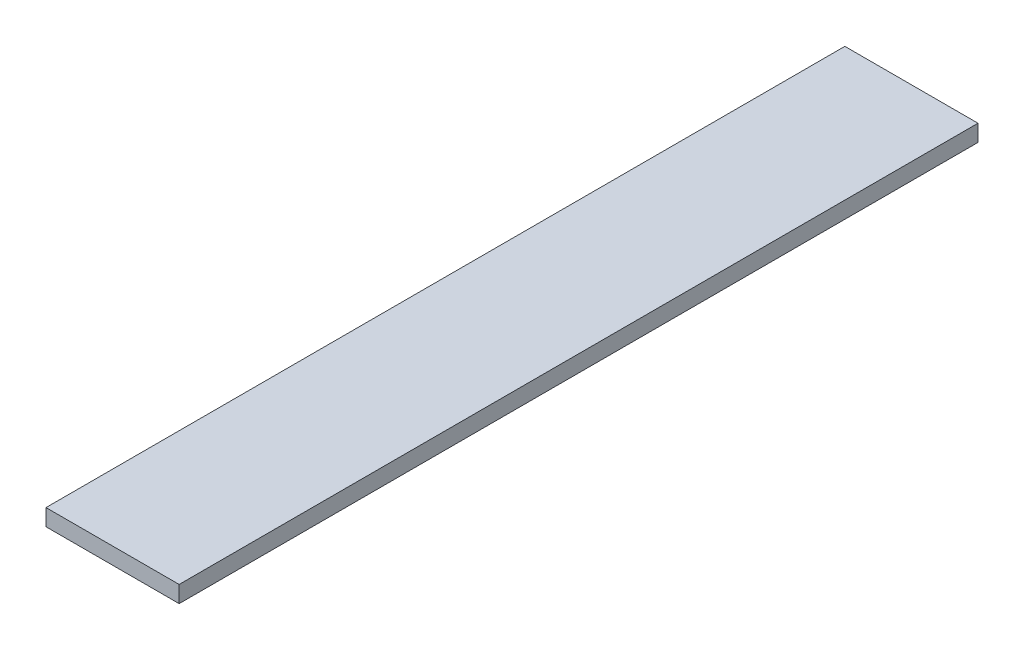
from build123d import *

# Parameters (mm, degrees)
BOSS_EXTRUDE1_DEPTH      = 76.2
BOSS_EXTRUDE1_DEPTH_BACK = 76.2
SKETCH3_W                = 25.4
SKETCH3_H                = 3.175


with BuildPart() as part:
    # Sketch3 → Boss-Extrude1 (new, two sides: drawn at the far end of the back side and taken through both)
    with BuildSketch(Plane.XY.offset(-BOSS_EXTRUDE1_DEPTH_BACK)):
        Rectangle(SKETCH3_W, SKETCH3_H)
    extrude(amount=BOSS_EXTRUDE1_DEPTH + BOSS_EXTRUDE1_DEPTH_BACK)


solid = part.part
